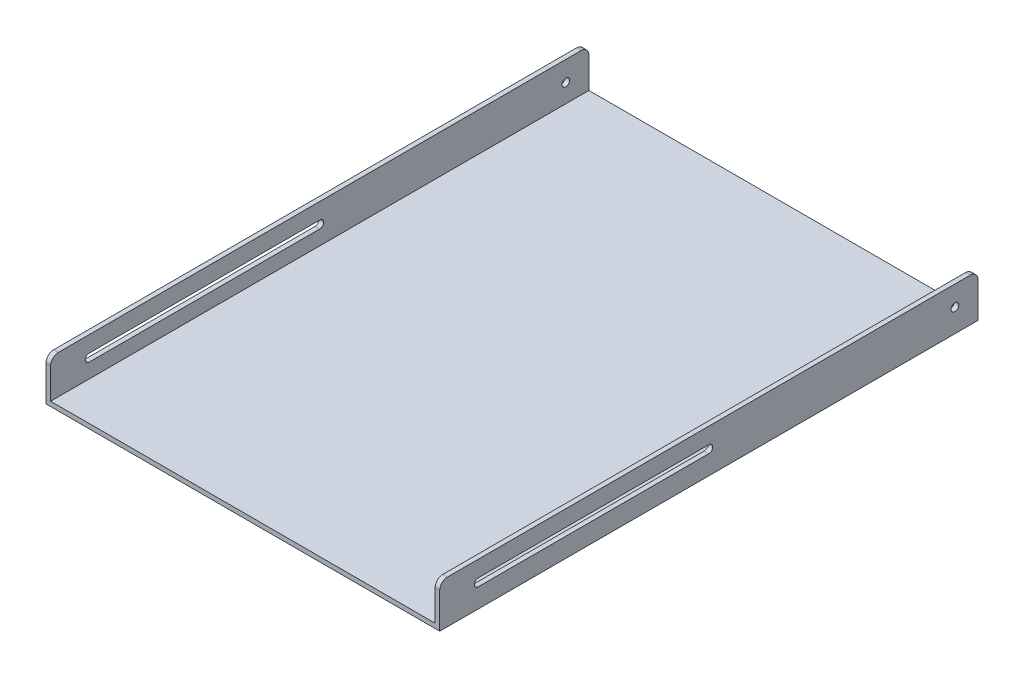
from build123d import *

# Parameters (mm, degrees)
EXTRUDE_THIN1_DEPTH = 350
SKETCH3_R           = 5
CUT_EXTRUDE1_DEPTH  = 623.208968113
FILLET1_R           = 10


with BuildPart() as part:
    # Sketch2 → Extrude-Thin1 (new, symmetric)
    with BuildSketch(Plane.XY):
        Polygon((-250, 50), (-250, 0), (250, 0), (250, 50), (256, 50), (256, -6), (-256, -6), (-256, 50), align=None)
    extrude(amount=EXTRUDE_THIN1_DEPTH, both=True)

    # Sketch3 → Cut-Extrude1 (cut, through all)
    with BuildSketch(Plane(origin=(256, 0, 0), x_dir=(0, 0, -1), z_dir=(1, 0, 0))):
        with Locations((320, 24)):
            Circle(SKETCH3_R)
        with BuildLine():
            Line((0, 19), (-300, 19))
            ThreePointArc((-300, 19), (-305, 24), (-300, 29))
            Line((-300, 29), (0, 29))
            ThreePointArc((0, 29), (5, 24), (0, 19))
        make_face()
    extrude(amount=-CUT_EXTRUDE1_DEPTH, mode=Mode.SUBTRACT)

    # Fillet1
    fillet1_edges = [part.edges().sort_by_distance(p)[0] for p in [
        (-253, 50, 350),
        (-253, 50, -350),
        (253, 50, 350),
        (253, 50, -350),
    ]]
    fillet(fillet1_edges, radius=FILLET1_R)


solid = part.part
